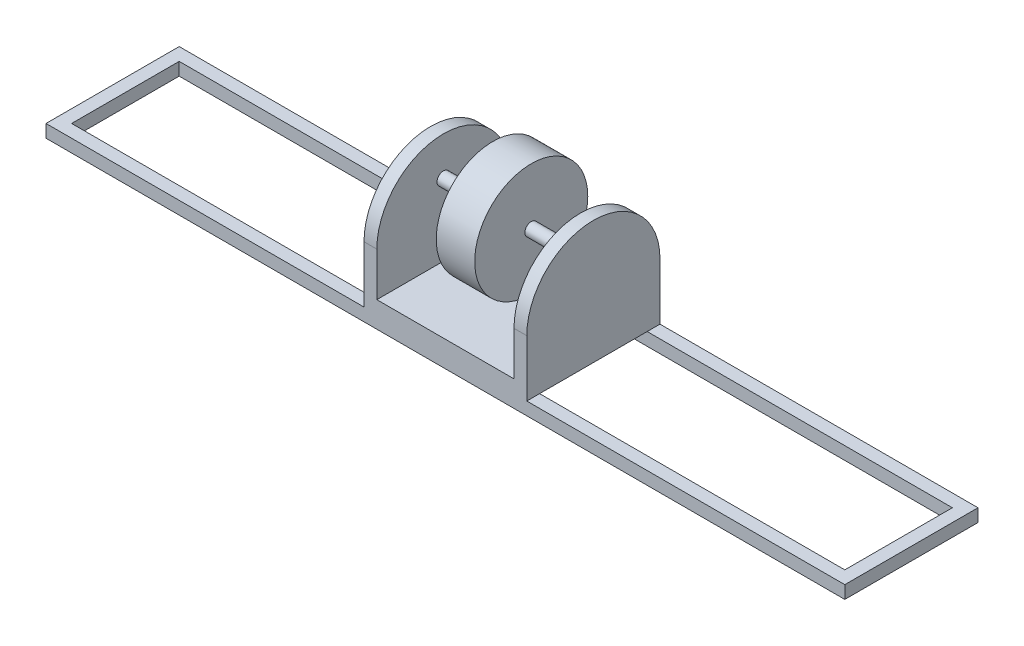
from build123d import *

# Parameters (mm, degrees)
BOSS_EXTRUDE1_DEPTH      = 20
SKETCH2_W                = 254
SKETCH2_H                = 207.844806097
BOSS_EXTRUDE2_DEPTH      = 20
SKETCH3_R                = 10
BOSS_EXTRUDE3_DEPTH      = 20
BOSS_EXTRUDE4_DEPTH      = 30
BOSS_EXTRUDE4_DEPTH_BACK = 30
SKETCH4_R                = 88.24460582
SKETCH5_R                = 10
BOSS_EXTRUDE5_DEPTH      = 254


with BuildPart() as part:
    # Sketch1 → Boss-Extrude1 (new body)
    with BuildSketch(Plane(origin=(0, 0, 0), x_dir=(1, 0, 0), z_dir=(0, 1, 0))):
        Polygon((-623.25, 811.094806097), (-623.25, 623.25), (-603.25, 623.25), (-603.25, 791.094806097), (603.25, 791.094806097), (603.25, 623.25), (623.25, 623.25), (623.25, 811.094806097), align=None)
        Polygon((-623.25, 623.25), (-623.25, 603.25), (-603.25, 603.25), (603.25, 603.25), (623.25, 603.25), (623.25, 623.25), (603.25, 623.25), (-603.25, 623.25), align=None)
    extrude(amount=BOSS_EXTRUDE1_DEPTH)

    # Sketch2 → Boss-Extrude2 (add)
    with BuildSketch(Plane(origin=(0, 20, 0), x_dir=(1, 0, 0), z_dir=(0, 1, 0))):
        with Locations((0, 707.172403048)):
            Rectangle(SKETCH2_W, SKETCH2_H)
    extrude(amount=BOSS_EXTRUDE2_DEPTH)

    # Sketch3 → Boss-Extrude3 (add)
    with BuildSketch(Plane.ZY.offset(127)):
        with BuildLine():
            Line((-811.094806097, 40), (-603.25, 40))
            Line((-603.25, 40), (-603.25, 108.279126424))
            ThreePointArc((-603.25, 108.279126424), (-707.172403048, 212.201529473), (-811.094806097, 108.279126424))
            Line((-811.094806097, 108.279126424), (-811.094806097, 40))
        make_face()
        with Locations((-707.172403048, 152.06935065)):
            Circle(SKETCH3_R, mode=Mode.SUBTRACT)
    boss_extrude3 = extrude(amount=-BOSS_EXTRUDE3_DEPTH)

    # Mirror1: Boss-Extrude3 across plane
    add(boss_extrude3.mirror(Plane(origin=(0, 0, 0), x_dir=(0, 0, 1), z_dir=(1, 0, 0))))



with BuildPart() as body_2:
    # Sketch4 → Boss-Extrude4 (new, two sides: drawn at the far end of the back side and taken through both)
    with BuildSketch(Plane(origin=(0, 0, 0), x_dir=(0, 0, -1), z_dir=(1, 0, 0)).offset(-BOSS_EXTRUDE4_DEPTH_BACK)):
        with Locations((707.172403048, 152.06935065)):
            Circle(SKETCH4_R)
    extrude(amount=BOSS_EXTRUDE4_DEPTH + BOSS_EXTRUDE4_DEPTH_BACK)


with BuildPart() as part_1:
    add(part.part)

    add(body_2.part)  # Boss-Extrude5 merges body 2
    # Sketch5 → Boss-Extrude5 (add)
    with BuildSketch(Plane.ZY.offset(127)):
        with Locations(Location((-707.172403048, 152.06935065, 0), (0, 0, 180))):
            Circle(SKETCH5_R)
    extrude(amount=-BOSS_EXTRUDE5_DEPTH)


solid = part_1.part
